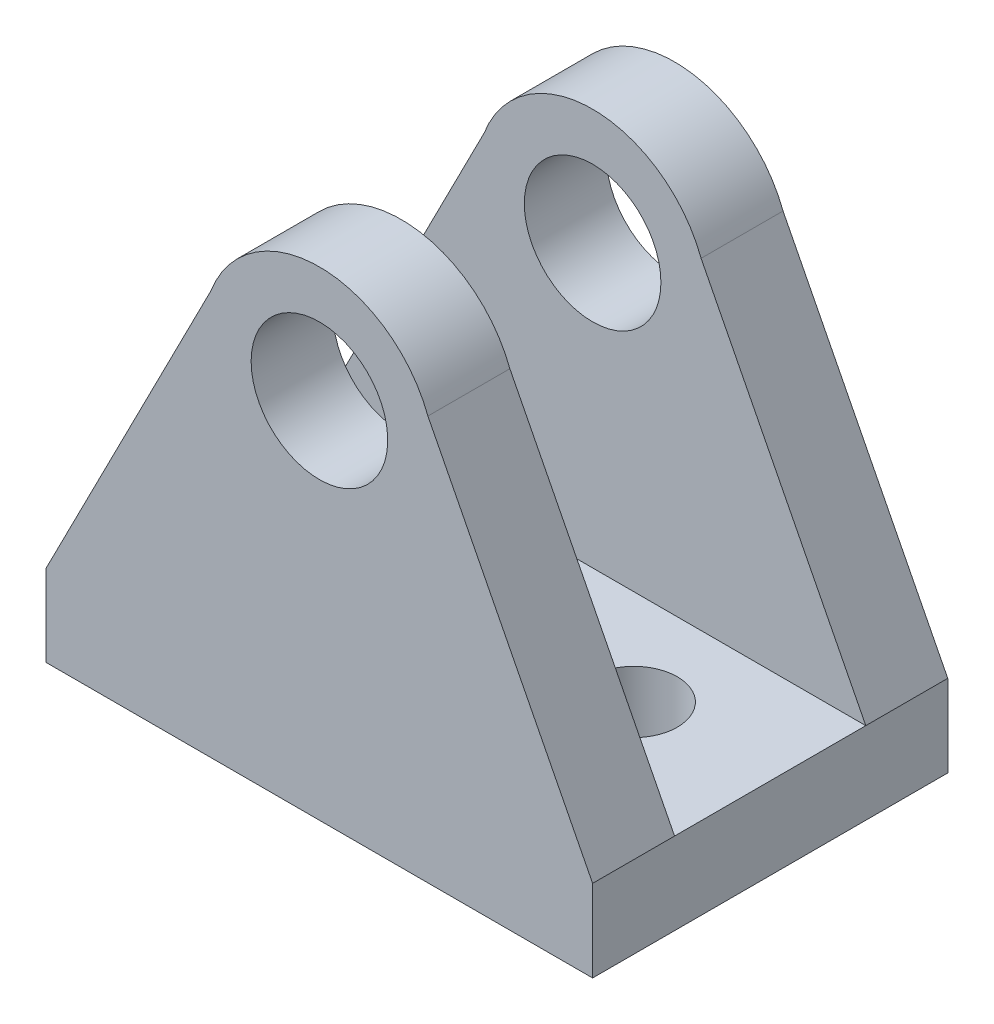
from build123d import *

# Parameters (mm, degrees)
SKETCH_1_W                  = 20
SKETCH_1_H                  = 7
EXTRUDE_1_DEPTH             = 3
EXTRUDE_2_DEPTH             = 3
EXTRUDE_3_DEPTH             = 3
HOLE_WIZARD_3_2_3_2_1_D     = 3.2
HOLE_WIZARD_3_2_3_2_1_DEPTH = 17.544769413
HOLE_WIZARD_5_0_5_1_D       = 5
HOLE_WIZARD_5_0_5_1_DEPTH   = 3
HOLE_WIZARD_5_0_5_2_D       = 5


with BuildPart() as part:
    # 草图1 → 凸台-拉伸1 (new body)
    with BuildSketch(Plane(origin=(0, 3, 0), x_dir=(1, 0, 0), z_dir=(0, 1, 0))):
        with Locations((35.343075637, 47.719425868)):
            Rectangle(SKETCH_1_W, SKETCH_1_H)
    extrude(amount=-EXTRUDE_1_DEPTH)

    # 草图2 → 凸台-拉伸2 (add)
    with BuildSketch(Plane.XY.offset(-44.219425868)):
        with BuildLine():
            Line((45.343075637, 0), (25.343075637, 0))
            Line((25.343075637, 0), (25.343075637, 3))
            Line((25.343075637, 3), (31.372178722, 14.8))
            ThreePointArc((31.372178722, 14.8), (35.343075637, 17.544764106), (39.313972553, 14.8))
            Line((39.313972553, 14.8), (45.343075637, 3))
            Line((45.343075637, 3), (45.343075637, 0))
        make_face()
    extrude(amount=EXTRUDE_2_DEPTH)

    # 草图3 → 凸台-拉伸3 (add)
    with BuildSketch(Plane(origin=(0, 0, -51.219425868), x_dir=(-1, 0, 0), z_dir=(0, 0, -1))):
        with BuildLine():
            Line((-25.343075637, 0), (-45.343075637, 0))
            Line((-45.343075637, 0), (-45.343075637, 3))
            Line((-45.343075637, 3), (-39.313966075, 14.800005308))
            ThreePointArc((-39.313966075, 14.800005308), (-35.34306916, 17.544769413), (-31.372172244, 14.800005308))
            Line((-31.372172244, 14.800005308), (-25.343075637, 3))
            Line((-25.343075637, 3), (-25.343075637, 0))
        make_face()
    extrude(amount=EXTRUDE_3_DEPTH)

    # Ø3.2 (3.2) 直径孔1
    with Locations(Plane(origin=(0, 0, 0), x_dir=(-1, 0, 0), z_dir=(0, -1, 0))):
        with Locations((-40.343075637, 47.719425868), (-30.343075637, 47.719425868)):
            Hole(HOLE_WIZARD_3_2_3_2_1_D / 2, depth=HOLE_WIZARD_3_2_3_2_1_DEPTH)

    # Ø5.0 (5) 直径孔1
    with Locations(Plane(origin=(0, 0, -54.219425868), x_dir=(-1, 0, 0), z_dir=(0, 0, -1))):
        with Locations((-35.34306916, 13.300005308)):
            Hole(HOLE_WIZARD_5_0_5_1_D / 2, depth=HOLE_WIZARD_5_0_5_1_DEPTH)

    # Ø5.0 (5) 直径孔2 (through all)
    with Locations(Plane(origin=(0, 0, -44.219425868), x_dir=(-1, 0, 0), z_dir=(0, 0, -1))):
        with Locations((-35.34306916, 13.300005308)):
            Hole(HOLE_WIZARD_5_0_5_2_D / 2)


solid = part.part
